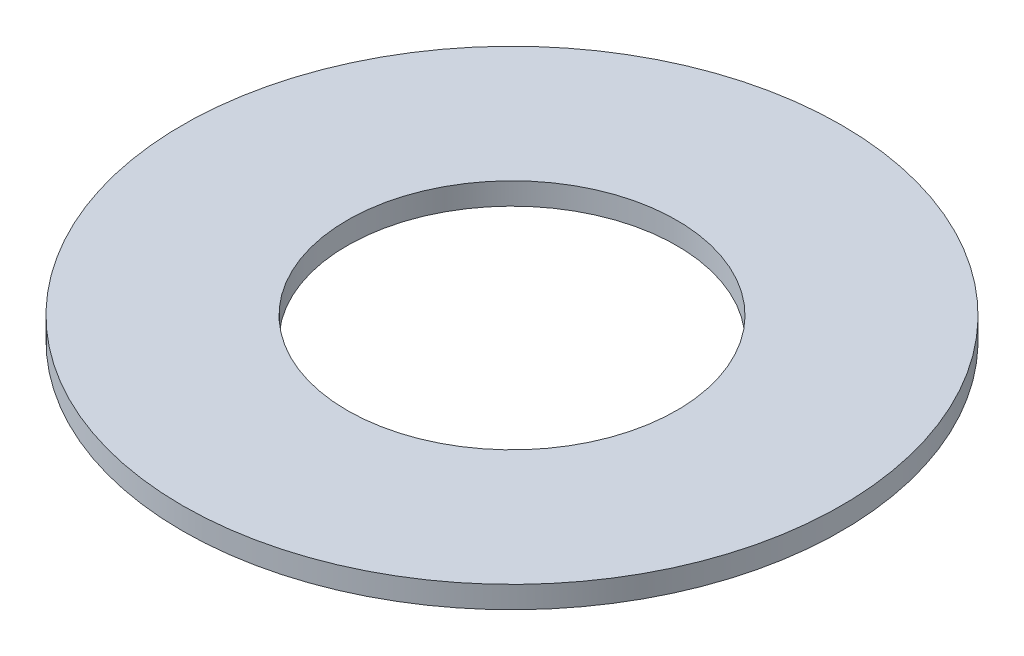
from build123d import *

# Parameters (mm, degrees)
SKETCH2_R           = 19.05
SKETCH2_R_2         = 9.525
BOSS_EXTRUDE1_DEPTH = 1.27


with BuildPart() as part:
    # Sketch2 → Boss-Extrude1 (new body)
    with BuildSketch(Plane(origin=(0, 0, 0), x_dir=(1, 0, 0), z_dir=(0, 1, 0))):
        with Locations(Location((0, 0, 0), (0, 0, 270))):
            Circle(SKETCH2_R)
        with Locations(Location((0, 0, 0), (0, 0, 270))):
            Circle(SKETCH2_R_2, mode=Mode.SUBTRACT)
    extrude(amount=BOSS_EXTRUDE1_DEPTH)


solid = part.part
